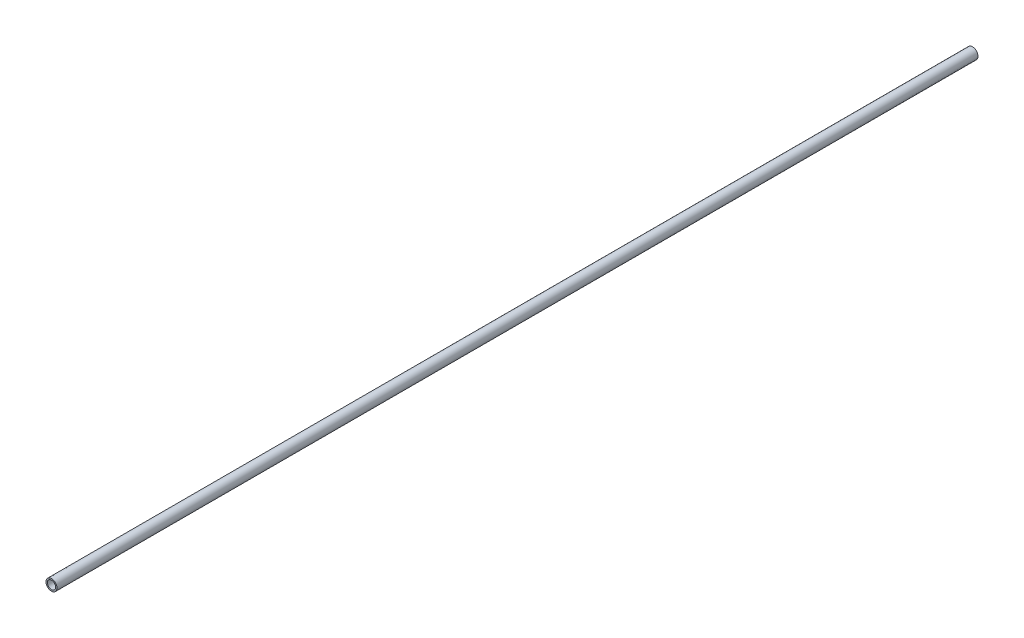
from build123d import *

# Parameters (mm, degrees)
SKETCH3_R           = 6.35
SKETCH3_R_2         = 4.7625
BOSS_EXTRUDE1_DEPTH = 533.4


with BuildPart() as part:
    # Sketch3 → Boss-Extrude1 (new, symmetric)
    with BuildSketch(Plane.XY):
        Circle(SKETCH3_R)
        Circle(SKETCH3_R_2, mode=Mode.SUBTRACT)
    extrude(amount=BOSS_EXTRUDE1_DEPTH, both=True)


solid = part.part
